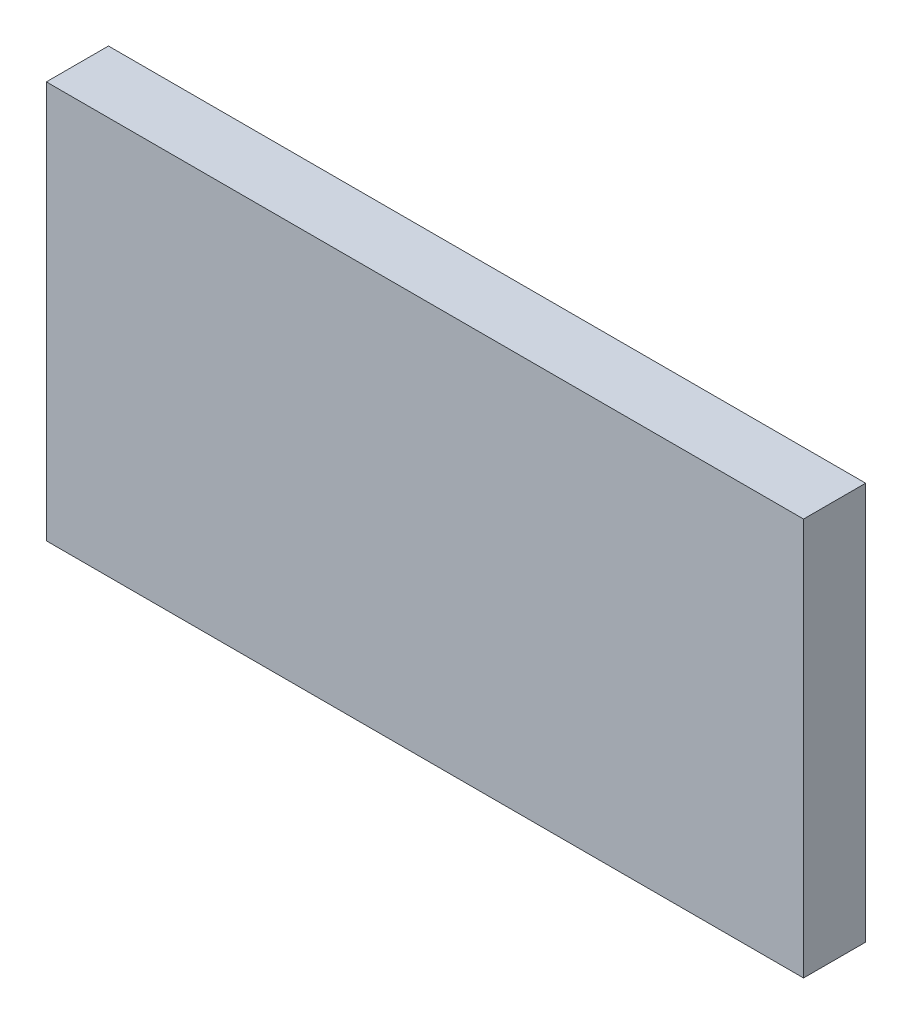
from build123d import *

# Parameters (mm, degrees)
SKETCH1_W           = 60.96
SKETCH1_H           = 32
BOSS_EXTRUDE1_DEPTH = 5


with BuildPart() as part:
    # Sketch1 → Boss-Extrude1 (new body)
    with BuildSketch(Plane.XY):
        with Locations((30.48, 16)):
            Rectangle(SKETCH1_W, SKETCH1_H)
    extrude(amount=-BOSS_EXTRUDE1_DEPTH)


solid = part.part
